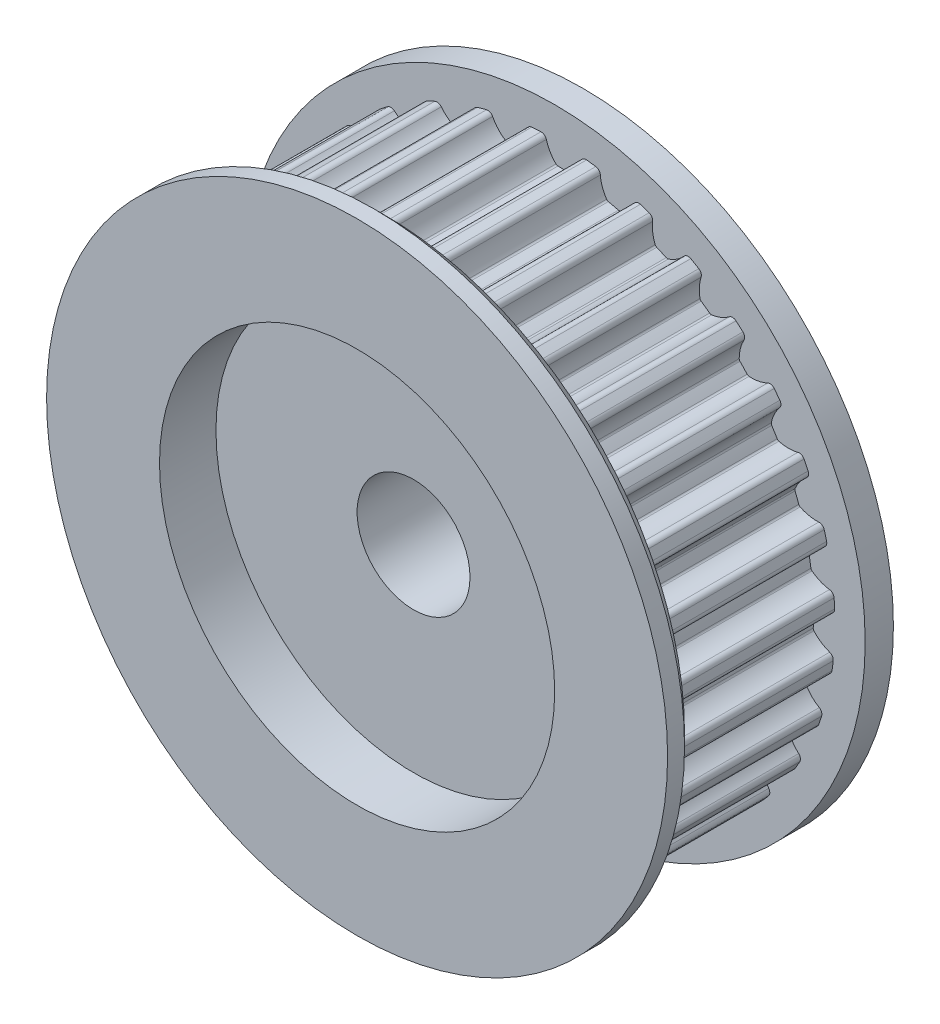
from build123d import *

# Parameters (mm, degrees)
BOSS_EXTRUDE1_DEPTH = 6
SKETCH2_R           = 11
BOSS_EXTRUDE2_DEPTH = 1
BOSS_EXTRUDE3_START = 1
SKETCH3_R           = 11
BOSS_EXTRUDE3_DEPTH = 1
SKETCH4_R           = 2
CUT_EXTRUDE1_DEPTH  = 18.492855685
CHAMFER1_SIZE       = 0.4
SKETCH5_R           = 7
CUT_EXTRUDE2_DEPTH  = 2


with BuildPart() as part:
    # Model → Boss-Extrude1 (new body)
    with BuildSketch(Plane.XY):
        with BuildLine():
            ThreePointArc((-2.731015397, 9.549145454), (-2.833543798, 9.476675356), (-2.86848663, 9.356081051))
            ThreePointArc((-2.86848663, 9.356081051), (-2.893499882, 9.017536319), (-3.003713406, 8.69645817))
            ThreePointArc((-3.003713406, 8.69645817), (-3.026976069, 8.665984152), (-3.059995667, 8.646502791))
            ThreePointArc((-3.059995667, 8.646502791), (-3.2331115, 8.583272921), (-3.40492191, 8.51657741))
            ThreePointArc((-3.40492191, 8.51657741), (-3.442588532, 8.509432981), (-3.480175251, 8.516986507))
            ThreePointArc((-3.480175251, 8.516986507), (-3.774829061, 8.685560914), (-4.016979165, 8.923471666))
            ThreePointArc((-4.016979165, 8.923471666), (-4.122799746, 8.991043795), (-4.247660567, 8.977861867))
            ThreePointArc((-4.247660567, 8.977861867), (-4.395171024, 8.906575979), (-4.541485564, 8.832866628))
            ThreePointArc((-4.541485564, 8.832866628), (-4.627905695, 8.741786725), (-4.638650329, 8.616692597))
            ThreePointArc((-4.638650329, 8.616692597), (-4.597136157, 8.279773063), (-4.64259272, 7.943362749))
            ThreePointArc((-4.64259272, 7.943362749), (-4.659463212, 7.908935961), (-4.688047722, 7.883387125))
            ThreePointArc((-4.688047722, 7.883387125), (-4.845501647, 7.787598975), (-5.00099912, 7.688666452))
            ThreePointArc((-5.00099912, 7.688666452), (-5.036548179, 7.674310907), (-5.0748863, 7.674386489))
            ThreePointArc((-5.0748863, 7.674386489), (-5.396765655, 7.782237679), (-5.680676997, 7.968335901))
            ThreePointArc((-5.680676997, 7.968335901), (-5.797646934, 8.013965079), (-5.917536923, 7.976677301))
            ThreePointArc((-5.917536923, 7.976677301), (-6.048305821, 7.877983288), (-6.177428987, 7.777145692))
            ThreePointArc((-6.177428987, 7.777145692), (-6.244419772, 7.670956132), (-6.230553297, 7.546169478))
            ThreePointArc((-6.230553297, 7.546169478), (-6.124107068, 7.223822772), (-6.1030598, 6.885008353))
            ThreePointArc((-6.1030598, 6.885008353), (-6.112889796, 6.847951796), (-6.135940732, 6.817317312))
            ThreePointArc((-6.135940732, 6.817317312), (-6.271681883, 6.692651967), (-6.404890738, 6.565284353))
            ThreePointArc((-6.404890738, 6.565284353), (-6.436956104, 6.544269369), (-6.474572314, 6.536864102))
            ThreePointArc((-6.474572314, 6.536864102), (-6.811307571, 6.579847415), (-7.126069598, 6.706981456))
            ThreePointArc((-7.126069598, 6.706981456), (-7.249693802, 6.72891418), (-7.360005654, 6.668953499))
            ThreePointArc((-7.360005654, 6.668953499), (-7.469007617, 6.546644118), (-7.575977278, 6.422553408))
            ThreePointArc((-7.575977278, 6.422553408), (-7.620964299, 6.305334997), (-7.583019596, 6.185651299))
            ThreePointArc((-7.583019596, 6.185651299), (-7.415731979, 5.890265023), (-7.328989713, 5.562066946))
            ThreePointArc((-7.328989713, 5.562066946), (-7.331401454, 5.523804683), (-7.348032981, 5.489261818))
            ThreePointArc((-7.348032981, 5.489261818), (-7.456844902, 5.340510098), (-7.562645997, 5.189602059))
            ThreePointArc((-7.562645997, 5.189602059), (-7.589995416, 5.162735229), (-7.625444145, 5.148133693))
            ThreePointArc((-7.625444145, 5.148133693), (-7.964094757, 5.124597304), (-8.297611341, 5.187881476))
            ThreePointArc((-8.297611341, 5.187881476), (-8.423139002, 5.185274883), (-8.519633495, 5.104945555))
            ThreePointArc((-8.519633495, 5.104945555), (-8.60267964, 4.963721086), (-8.683385012, 4.821145998))
            ThreePointArc((-8.683385012, 4.821145998), (-8.704639442, 4.697403374), (-8.644074704, 4.587422009))
            ThreePointArc((-8.644074704, 4.587422009), (-8.422374468, 4.330347693), (-8.273270663, 4.025378426))
            ThreePointArc((-8.273270663, 4.025378426), (-8.268171465, 3.987380855), (-8.277744444, 3.950257071))
            ThreePointArc((-8.277744444, 3.950257071), (-8.355445553, 3.783135421), (-8.429773011, 3.614486267))
            ThreePointArc((-8.429773011, 3.614486267), (-8.45135546, 3.582800069), (-8.483274434, 3.561563394))
            ThreePointArc((-8.483274434, 3.561563394), (-8.810826248, 3.472411793), (-9.150280534, 3.469414119))
            ThreePointArc((-9.150280534, 3.469414119), (-9.272887695, 3.442368379), (-9.351856598, 3.344757415))
            ThreePointArc((-9.351856598, 3.344757415), (-9.405755508, 3.190045036), (-9.457095129, 3.034464652))
            ThreePointArc((-9.457095129, 3.034464652), (-9.453800172, 2.908953173), (-9.372942869, 2.812900664))
            ThreePointArc((-9.372942869, 2.812900664), (-9.10534983, 2.604017529), (-8.89961446, 2.333996871))
            ThreePointArc((-8.89961446, 2.333996871), (-8.887200283, 2.297724216), (-8.889346829, 2.25944616))
            ThreePointArc((-8.889346829, 2.25944616), (-8.932951117, 2.080376971), (-8.972948576, 1.900467796))
            ThreePointArc((-8.972948576, 1.900467796), (-8.987934654, 1.865179912), (-9.015097244, 1.838124211))
            ThreePointArc((-9.015097244, 1.838124211), (-9.318962627, 1.686783444), (-9.651309577, 1.617619124))
            ThreePointArc((-9.651309577, 1.617619124), (-9.766284514, 1.56717359), (-9.824693097, 1.456032124))
            ThreePointArc((-9.824693097, 1.456032124), (-9.847373466, 1.293777344), (-9.867374384, 1.13117053))
            ThreePointArc((-9.867374384, 1.13117053), (-9.839656664, 1.008713534), (-9.741614097, 0.930281124))
            ThreePointArc((-9.741614097, 0.930281124), (-9.438411705, 0.777616432), (-9.183951065, 0.552921124))
            ThreePointArc((-9.183951065, 0.552921124), (-9.164698979, 0.519767324), (-9.159336601, 0.481806))
            ThreePointArc((-9.159336601, 0.481806), (-9.167168379, 0.297670801), (-9.17129876, 0.113415413))
            ThreePointArc((-9.17129876, 0.113415413), (-9.17911256, 0.075881937), (-9.200474922, 0.044046945))
            ThreePointArc((-9.200474922, 0.044046945), (-9.468976498, -0.163667046), (-9.781444205, -0.296340067))
            ThreePointArc((-9.781444205, -0.296340067), (-9.884368495, -0.368246802), (-9.91997215, -0.488647665))
            ThreePointArc((-9.91997215, -0.488647665), (-9.910562385, -0.652209485), (-9.898455975, -0.81559384))
            ThreePointArc((-9.898455975, -0.81559384), (-9.847380668, -0.930290401), (-9.735920557, -0.988088598))
            ThreePointArc((-9.735920557, -0.988088598), (-9.408760711, -1.078668029), (-9.115353581, -1.249403071))
            ThreePointArc((-9.115353581, -1.249403071), (-9.090003433, -1.278163934), (-9.077338205, -1.314349694))
            ThreePointArc((-9.077338205, -1.314349694), (-9.049096502, -1.496474691), (-9.017201075, -1.677995461))
            ThreePointArc((-9.017201075, -1.677995461), (-9.017542317, -1.716332138), (-9.032283509, -1.75172302))
            ThreePointArc((-9.032283509, -1.75172302), (-9.255102913, -2.007827904), (-9.535683419, -2.198911076))
            ThreePointArc((-9.535683419, -2.198911076), (-9.622601739, -2.289515676), (-9.634032237, -2.414548998))
            ThreePointArc((-9.634032237, -2.414548998), (-9.592893949, -2.57313227), (-9.549145454, -2.731015397))
            ThreePointArc((-9.549145454, -2.731015397), (-9.476675356, -2.833543798), (-9.356081051, -2.86848663))
            ThreePointArc((-9.356081051, -2.86848663), (-9.017536319, -2.893499882), (-8.69645817, -3.003713406))
            ThreePointArc((-8.69645817, -3.003713406), (-8.665984152, -3.026976069), (-8.646502791, -3.059995667))
            ThreePointArc((-8.646502791, -3.059995667), (-8.583272921, -3.2331115), (-8.51657741, -3.40492191))
            ThreePointArc((-8.51657741, -3.40492191), (-8.509432981, -3.442588532), (-8.516986507, -3.480175251))
            ThreePointArc((-8.516986507, -3.480175251), (-8.685560914, -3.774829061), (-8.923471666, -4.016979165))
            ThreePointArc((-8.923471666, -4.016979165), (-8.991043795, -4.122799746), (-8.977861867, -4.247660567))
            ThreePointArc((-8.977861867, -4.247660567), (-8.906575979, -4.395171024), (-8.832866628, -4.541485564))
            ThreePointArc((-8.832866628, -4.541485564), (-8.741786725, -4.627905695), (-8.616692597, -4.638650329))
            ThreePointArc((-8.616692597, -4.638650329), (-8.279773063, -4.597136157), (-7.943362749, -4.64259272))
            ThreePointArc((-7.943362749, -4.64259272), (-7.908935961, -4.659463212), (-7.883387125, -4.688047722))
            ThreePointArc((-7.883387125, -4.688047722), (-7.787598975, -4.845501647), (-7.688666452, -5.00099912))
            ThreePointArc((-7.688666452, -5.00099912), (-7.674310907, -5.036548179), (-7.674386489, -5.0748863))
            ThreePointArc((-7.674386489, -5.0748863), (-7.782237679, -5.396765655), (-7.968335901, -5.680676997))
            ThreePointArc((-7.968335901, -5.680676997), (-8.013965079, -5.797646934), (-7.976677301, -5.917536923))
            ThreePointArc((-7.976677301, -5.917536923), (-7.877983288, -6.048305821), (-7.777145692, -6.177428987))
            ThreePointArc((-7.777145692, -6.177428987), (-7.670956132, -6.244419772), (-7.546169478, -6.230553297))
            ThreePointArc((-7.546169478, -6.230553297), (-7.223822772, -6.124107068), (-6.885008353, -6.1030598))
            ThreePointArc((-6.885008353, -6.1030598), (-6.847951796, -6.112889796), (-6.817317312, -6.135940732))
            ThreePointArc((-6.817317312, -6.135940732), (-6.692651967, -6.271681883), (-6.565284353, -6.404890738))
            ThreePointArc((-6.565284353, -6.404890738), (-6.544269369, -6.436956104), (-6.536864102, -6.474572314))
            ThreePointArc((-6.536864102, -6.474572314), (-6.579847415, -6.811307571), (-6.706981456, -7.126069598))
            ThreePointArc((-6.706981456, -7.126069598), (-6.72891418, -7.249693802), (-6.668953499, -7.360005654))
            ThreePointArc((-6.668953499, -7.360005654), (-6.546644118, -7.469007617), (-6.422553408, -7.575977278))
            ThreePointArc((-6.422553408, -7.575977278), (-6.305334997, -7.620964299), (-6.185651299, -7.583019596))
            ThreePointArc((-6.185651299, -7.583019596), (-5.890265023, -7.415731979), (-5.562066946, -7.328989713))
            ThreePointArc((-5.562066946, -7.328989713), (-5.523804683, -7.331401454), (-5.489261818, -7.348032981))
            ThreePointArc((-5.489261818, -7.348032981), (-5.340510098, -7.456844902), (-5.189602059, -7.562645997))
            ThreePointArc((-5.189602059, -7.562645997), (-5.162735229, -7.589995416), (-5.148133693, -7.625444145))
            ThreePointArc((-5.148133693, -7.625444145), (-5.124597304, -7.964094757), (-5.187881476, -8.297611341))
            ThreePointArc((-5.187881476, -8.297611341), (-5.185274883, -8.423139002), (-5.104945555, -8.519633495))
            ThreePointArc((-5.104945555, -8.519633495), (-4.963721086, -8.60267964), (-4.821145998, -8.683385012))
            ThreePointArc((-4.821145998, -8.683385012), (-4.697403374, -8.704639442), (-4.587422009, -8.644074704))
            ThreePointArc((-4.587422009, -8.644074704), (-4.330347693, -8.422374468), (-4.025378426, -8.273270663))
            ThreePointArc((-4.025378426, -8.273270663), (-3.987380855, -8.268171465), (-3.950257071, -8.277744444))
            ThreePointArc((-3.950257071, -8.277744444), (-3.783135421, -8.355445553), (-3.614486267, -8.429773011))
            ThreePointArc((-3.614486267, -8.429773011), (-3.582800069, -8.45135546), (-3.561563394, -8.483274434))
            ThreePointArc((-3.561563394, -8.483274434), (-3.472411793, -8.810826248), (-3.469414119, -9.150280534))
            ThreePointArc((-3.469414119, -9.150280534), (-3.442368379, -9.272887695), (-3.344757415, -9.351856598))
            ThreePointArc((-3.344757415, -9.351856598), (-3.190045036, -9.405755508), (-3.034464652, -9.457095129))
            ThreePointArc((-3.034464652, -9.457095129), (-2.908953173, -9.453800172), (-2.812900664, -9.372942869))
            ThreePointArc((-2.812900664, -9.372942869), (-2.604017529, -9.10534983), (-2.333996871, -8.89961446))
            ThreePointArc((-2.333996871, -8.89961446), (-2.297724216, -8.887200283), (-2.25944616, -8.889346829))
            ThreePointArc((-2.25944616, -8.889346829), (-2.080376971, -8.932951117), (-1.900467796, -8.972948576))
            ThreePointArc((-1.900467796, -8.972948576), (-1.865179912, -8.987934654), (-1.838124211, -9.015097244))
            ThreePointArc((-1.838124211, -9.015097244), (-1.686783444, -9.318962627), (-1.617619124, -9.651309577))
            ThreePointArc((-1.617619124, -9.651309577), (-1.56717359, -9.766284514), (-1.456032124, -9.824693097))
            ThreePointArc((-1.456032124, -9.824693097), (-1.293777344, -9.847373466), (-1.13117053, -9.867374384))
            ThreePointArc((-1.13117053, -9.867374384), (-1.008713534, -9.839656664), (-0.930281124, -9.741614097))
            ThreePointArc((-0.930281124, -9.741614097), (-0.777616432, -9.438411705), (-0.552921124, -9.183951065))
            ThreePointArc((-0.552921124, -9.183951065), (-0.519767324, -9.164698979), (-0.481806, -9.159336601))
            ThreePointArc((-0.481806, -9.159336601), (-0.297670801, -9.167168379), (-0.113415413, -9.17129876))
            ThreePointArc((-0.113415413, -9.17129876), (-0.075881937, -9.17911256), (-0.044046945, -9.200474922))
            ThreePointArc((-0.044046945, -9.200474922), (0.163667046, -9.468976498), (0.296340067, -9.781444205))
            ThreePointArc((0.296340067, -9.781444205), (0.368246802, -9.884368495), (0.488647665, -9.91997215))
            ThreePointArc((0.488647665, -9.91997215), (0.652209485, -9.910562385), (0.81559384, -9.898455975))
            ThreePointArc((0.81559384, -9.898455975), (0.930290401, -9.847380668), (0.988088598, -9.735920557))
            ThreePointArc((0.988088598, -9.735920557), (1.078668029, -9.408760711), (1.249403071, -9.115353581))
            ThreePointArc((1.249403071, -9.115353581), (1.278163934, -9.090003433), (1.314349694, -9.077338205))
            ThreePointArc((1.314349694, -9.077338205), (1.496474691, -9.049096502), (1.677995461, -9.017201075))
            ThreePointArc((1.677995461, -9.017201075), (1.716332138, -9.017542317), (1.75172302, -9.032283509))
            ThreePointArc((1.75172302, -9.032283509), (2.007827904, -9.255102913), (2.198911076, -9.535683419))
            ThreePointArc((2.198911076, -9.535683419), (2.289515676, -9.622601739), (2.414548998, -9.634032237))
            ThreePointArc((2.414548998, -9.634032237), (2.57313227, -9.592893949), (2.731015397, -9.549145454))
            ThreePointArc((2.731015397, -9.549145454), (2.833543798, -9.476675356), (2.86848663, -9.356081051))
            ThreePointArc((2.86848663, -9.356081051), (2.893499882, -9.017536319), (3.003713406, -8.69645817))
            ThreePointArc((3.003713406, -8.69645817), (3.026976069, -8.665984152), (3.059995667, -8.646502791))
            ThreePointArc((3.059995667, -8.646502791), (3.2331115, -8.583272921), (3.40492191, -8.51657741))
            ThreePointArc((3.40492191, -8.51657741), (3.442588532, -8.509432981), (3.480175251, -8.516986507))
            ThreePointArc((3.480175251, -8.516986507), (3.774829061, -8.685560914), (4.016979165, -8.923471666))
            ThreePointArc((4.016979165, -8.923471666), (4.122799746, -8.991043795), (4.247660567, -8.977861867))
            ThreePointArc((4.247660567, -8.977861867), (4.395171024, -8.906575979), (4.541485564, -8.832866628))
            ThreePointArc((4.541485564, -8.832866628), (4.627905695, -8.741786725), (4.638650329, -8.616692597))
            ThreePointArc((4.638650329, -8.616692597), (4.597136157, -8.279773063), (4.64259272, -7.943362749))
            ThreePointArc((4.64259272, -7.943362749), (4.659463212, -7.908935961), (4.688047722, -7.883387125))
            ThreePointArc((4.688047722, -7.883387125), (4.845501647, -7.787598975), (5.00099912, -7.688666452))
            ThreePointArc((5.00099912, -7.688666452), (5.036548179, -7.674310907), (5.0748863, -7.674386489))
            ThreePointArc((5.0748863, -7.674386489), (5.396765655, -7.782237679), (5.680676997, -7.968335901))
            ThreePointArc((5.680676997, -7.968335901), (5.797646934, -8.013965079), (5.917536923, -7.976677301))
            ThreePointArc((5.917536923, -7.976677301), (6.048305821, -7.877983288), (6.177428987, -7.777145692))
            ThreePointArc((6.177428987, -7.777145692), (6.244419772, -7.670956132), (6.230553297, -7.546169478))
            ThreePointArc((6.230553297, -7.546169478), (6.124107068, -7.223822772), (6.1030598, -6.885008353))
            ThreePointArc((6.1030598, -6.885008353), (6.112889796, -6.847951796), (6.135940732, -6.817317312))
            ThreePointArc((6.135940732, -6.817317312), (6.271681883, -6.692651967), (6.404890738, -6.565284353))
            ThreePointArc((6.404890738, -6.565284353), (6.436956104, -6.544269369), (6.474572314, -6.536864102))
            ThreePointArc((6.474572314, -6.536864102), (6.811307571, -6.579847415), (7.126069598, -6.706981456))
            ThreePointArc((7.126069598, -6.706981456), (7.249693802, -6.72891418), (7.360005654, -6.668953499))
            ThreePointArc((7.360005654, -6.668953499), (7.469007617, -6.546644118), (7.575977278, -6.422553408))
            ThreePointArc((7.575977278, -6.422553408), (7.620964299, -6.305334997), (7.583019596, -6.185651299))
            ThreePointArc((7.583019596, -6.185651299), (7.415731979, -5.890265023), (7.328989713, -5.562066946))
            ThreePointArc((7.328989713, -5.562066946), (7.331401454, -5.523804683), (7.348032981, -5.489261818))
            ThreePointArc((7.348032981, -5.489261818), (7.456844902, -5.340510098), (7.562645997, -5.189602059))
            ThreePointArc((7.562645997, -5.189602059), (7.589995416, -5.162735229), (7.625444145, -5.148133693))
            ThreePointArc((7.625444145, -5.148133693), (7.964094757, -5.124597304), (8.297611341, -5.187881476))
            ThreePointArc((8.297611341, -5.187881476), (8.423139002, -5.185274883), (8.519633495, -5.104945555))
            ThreePointArc((8.519633495, -5.104945555), (8.60267964, -4.963721086), (8.683385012, -4.821145998))
            ThreePointArc((8.683385012, -4.821145998), (8.704639442, -4.697403374), (8.644074704, -4.587422009))
            ThreePointArc((8.644074704, -4.587422009), (8.422374468, -4.330347693), (8.273270663, -4.025378426))
            ThreePointArc((8.273270663, -4.025378426), (8.268171465, -3.987380855), (8.277744444, -3.950257071))
            ThreePointArc((8.277744444, -3.950257071), (8.355445553, -3.783135421), (8.429773011, -3.614486267))
            ThreePointArc((8.429773011, -3.614486267), (8.45135546, -3.582800069), (8.483274434, -3.561563394))
            ThreePointArc((8.483274434, -3.561563394), (8.810826248, -3.472411793), (9.150280534, -3.469414119))
            ThreePointArc((9.150280534, -3.469414119), (9.272887695, -3.442368379), (9.351856598, -3.344757415))
            ThreePointArc((9.351856598, -3.344757415), (9.405755508, -3.190045036), (9.457095129, -3.034464652))
            ThreePointArc((9.457095129, -3.034464652), (9.453800172, -2.908953173), (9.372942869, -2.812900664))
            ThreePointArc((9.372942869, -2.812900664), (9.10534983, -2.604017529), (8.89961446, -2.333996871))
            ThreePointArc((8.89961446, -2.333996871), (8.887200283, -2.297724216), (8.889346829, -2.25944616))
            ThreePointArc((8.889346829, -2.25944616), (8.932951117, -2.080376971), (8.972948576, -1.900467796))
            ThreePointArc((8.972948576, -1.900467796), (8.987934654, -1.865179912), (9.015097244, -1.838124211))
            ThreePointArc((9.015097244, -1.838124211), (9.318962627, -1.686783444), (9.651309577, -1.617619124))
            ThreePointArc((9.651309577, -1.617619124), (9.766284514, -1.56717359), (9.824693097, -1.456032124))
            ThreePointArc((9.824693097, -1.456032124), (9.847373466, -1.293777344), (9.867374384, -1.13117053))
            ThreePointArc((9.867374384, -1.13117053), (9.839656664, -1.008713534), (9.741614097, -0.930281124))
            ThreePointArc((9.741614097, -0.930281124), (9.438411705, -0.777616432), (9.183951065, -0.552921124))
            ThreePointArc((9.183951065, -0.552921124), (9.164698979, -0.519767324), (9.159336601, -0.481806))
            ThreePointArc((9.159336601, -0.481806), (9.167168379, -0.297670801), (9.17129876, -0.113415413))
            ThreePointArc((9.17129876, -0.113415413), (9.17911256, -0.075881937), (9.200474922, -0.044046945))
            ThreePointArc((9.200474922, -0.044046945), (9.468976498, 0.163667046), (9.781444205, 0.296340067))
            ThreePointArc((9.781444205, 0.296340067), (9.884368495, 0.368246802), (9.91997215, 0.488647665))
            ThreePointArc((9.91997215, 0.488647665), (9.910562385, 0.652209485), (9.898455975, 0.81559384))
            ThreePointArc((9.898455975, 0.81559384), (9.847380668, 0.930290401), (9.735920557, 0.988088598))
            ThreePointArc((9.735920557, 0.988088598), (9.408760711, 1.078668029), (9.115353581, 1.249403071))
            ThreePointArc((9.115353581, 1.249403071), (9.090003433, 1.278163934), (9.077338205, 1.314349694))
            ThreePointArc((9.077338205, 1.314349694), (9.049096502, 1.496474691), (9.017201075, 1.677995461))
            ThreePointArc((9.017201075, 1.677995461), (9.017542317, 1.716332138), (9.032283509, 1.75172302))
            ThreePointArc((9.032283509, 1.75172302), (9.255102913, 2.007827904), (9.535683419, 2.198911076))
            ThreePointArc((9.535683419, 2.198911076), (9.622601739, 2.289515676), (9.634032237, 2.414548998))
            ThreePointArc((9.634032237, 2.414548998), (9.592893949, 2.57313227), (9.549145454, 2.731015397))
            ThreePointArc((9.549145454, 2.731015397), (9.476675356, 2.833543798), (9.356081051, 2.86848663))
            ThreePointArc((9.356081051, 2.86848663), (9.017536319, 2.893499882), (8.69645817, 3.003713406))
            ThreePointArc((8.69645817, 3.003713406), (8.665984152, 3.026976069), (8.646502791, 3.059995667))
            ThreePointArc((8.646502791, 3.059995667), (8.583272921, 3.2331115), (8.51657741, 3.40492191))
            ThreePointArc((8.51657741, 3.40492191), (8.509432981, 3.442588532), (8.516986507, 3.480175251))
            ThreePointArc((8.516986507, 3.480175251), (8.685560914, 3.774829061), (8.923471666, 4.016979165))
            ThreePointArc((8.923471666, 4.016979165), (8.991043795, 4.122799746), (8.977861867, 4.247660567))
            ThreePointArc((8.977861867, 4.247660567), (8.906575979, 4.395171024), (8.832866628, 4.541485564))
            ThreePointArc((8.832866628, 4.541485564), (8.741786725, 4.627905695), (8.616692597, 4.638650329))
            ThreePointArc((8.616692597, 4.638650329), (8.279773063, 4.597136157), (7.943362749, 4.64259272))
            ThreePointArc((7.943362749, 4.64259272), (7.908935961, 4.659463212), (7.883387125, 4.688047722))
            ThreePointArc((7.883387125, 4.688047722), (7.787598975, 4.845501647), (7.688666452, 5.00099912))
            ThreePointArc((7.688666452, 5.00099912), (7.674310907, 5.036548179), (7.674386489, 5.0748863))
            ThreePointArc((7.674386489, 5.0748863), (7.782237679, 5.396765655), (7.968335901, 5.680676997))
            ThreePointArc((7.968335901, 5.680676997), (8.013965079, 5.797646934), (7.976677301, 5.917536923))
            ThreePointArc((7.976677301, 5.917536923), (7.877983288, 6.048305821), (7.777145692, 6.177428987))
            ThreePointArc((7.777145692, 6.177428987), (7.670956132, 6.244419772), (7.546169478, 6.230553297))
            ThreePointArc((7.546169478, 6.230553297), (7.223822772, 6.124107068), (6.885008353, 6.1030598))
            ThreePointArc((6.885008353, 6.1030598), (6.847951796, 6.112889796), (6.817317312, 6.135940732))
            ThreePointArc((6.817317312, 6.135940732), (6.692651967, 6.271681883), (6.565284353, 6.404890738))
            ThreePointArc((6.565284353, 6.404890738), (6.544269369, 6.436956104), (6.536864102, 6.474572314))
            ThreePointArc((6.536864102, 6.474572314), (6.579847415, 6.811307571), (6.706981456, 7.126069598))
            ThreePointArc((6.706981456, 7.126069598), (6.72891418, 7.249693802), (6.668953499, 7.360005654))
            ThreePointArc((6.668953499, 7.360005654), (6.546644118, 7.469007617), (6.422553408, 7.575977278))
            ThreePointArc((6.422553408, 7.575977278), (6.305334997, 7.620964299), (6.185651299, 7.583019596))
            ThreePointArc((6.185651299, 7.583019596), (5.890265023, 7.415731979), (5.562066946, 7.328989713))
            ThreePointArc((5.562066946, 7.328989713), (5.523804683, 7.331401454), (5.489261818, 7.348032981))
            ThreePointArc((5.489261818, 7.348032981), (5.340510098, 7.456844902), (5.189602059, 7.562645997))
            ThreePointArc((5.189602059, 7.562645997), (5.162735229, 7.589995416), (5.148133693, 7.625444145))
            ThreePointArc((5.148133693, 7.625444145), (5.124597304, 7.964094757), (5.187881476, 8.297611341))
            ThreePointArc((5.187881476, 8.297611341), (5.185274883, 8.423139002), (5.104945555, 8.519633495))
            ThreePointArc((5.104945555, 8.519633495), (4.963721086, 8.60267964), (4.821145998, 8.683385012))
            ThreePointArc((4.821145998, 8.683385012), (4.697403374, 8.704639442), (4.587422009, 8.644074704))
            ThreePointArc((4.587422009, 8.644074704), (4.330347693, 8.422374468), (4.025378426, 8.273270663))
            ThreePointArc((4.025378426, 8.273270663), (3.987380855, 8.268171465), (3.950257071, 8.277744444))
            ThreePointArc((3.950257071, 8.277744444), (3.783135421, 8.355445553), (3.614486267, 8.429773011))
            ThreePointArc((3.614486267, 8.429773011), (3.582800069, 8.45135546), (3.561563394, 8.483274434))
            ThreePointArc((3.561563394, 8.483274434), (3.472411793, 8.810826248), (3.469414119, 9.150280534))
            ThreePointArc((3.469414119, 9.150280534), (3.442368379, 9.272887695), (3.344757415, 9.351856598))
            ThreePointArc((3.344757415, 9.351856598), (3.190045036, 9.405755508), (3.034464652, 9.457095129))
            ThreePointArc((3.034464652, 9.457095129), (2.908953173, 9.453800172), (2.812900664, 9.372942869))
            ThreePointArc((2.812900664, 9.372942869), (2.604017529, 9.10534983), (2.333996871, 8.89961446))
            ThreePointArc((2.333996871, 8.89961446), (2.297724216, 8.887200283), (2.25944616, 8.889346829))
            ThreePointArc((2.25944616, 8.889346829), (2.080376971, 8.932951117), (1.900467796, 8.972948576))
            ThreePointArc((1.900467796, 8.972948576), (1.865179912, 8.987934654), (1.838124211, 9.015097244))
            ThreePointArc((1.838124211, 9.015097244), (1.686783444, 9.318962627), (1.617619124, 9.651309577))
            ThreePointArc((1.617619124, 9.651309577), (1.56717359, 9.766284514), (1.456032124, 9.824693097))
            ThreePointArc((1.456032124, 9.824693097), (1.293777344, 9.847373466), (1.13117053, 9.867374384))
            ThreePointArc((1.13117053, 9.867374384), (1.008713534, 9.839656664), (0.930281124, 9.741614097))
            ThreePointArc((0.930281124, 9.741614097), (0.777616432, 9.438411705), (0.552921124, 9.183951065))
            ThreePointArc((0.552921124, 9.183951065), (0.519767324, 9.164698979), (0.481806, 9.159336601))
            ThreePointArc((0.481806, 9.159336601), (0.297670801, 9.167168379), (0.113415413, 9.17129876))
            ThreePointArc((0.113415413, 9.17129876), (0.075881937, 9.17911256), (0.044046945, 9.200474922))
            ThreePointArc((0.044046945, 9.200474922), (-0.163667046, 9.468976498), (-0.296340067, 9.781444205))
            ThreePointArc((-0.296340067, 9.781444205), (-0.368246802, 9.884368495), (-0.488647665, 9.91997215))
            ThreePointArc((-0.488647665, 9.91997215), (-0.652209485, 9.910562385), (-0.81559384, 9.898455975))
            ThreePointArc((-0.81559384, 9.898455975), (-0.930290401, 9.847380668), (-0.988088598, 9.735920557))
            ThreePointArc((-0.988088598, 9.735920557), (-1.078668029, 9.408760711), (-1.249403071, 9.115353581))
            ThreePointArc((-1.249403071, 9.115353581), (-1.278163934, 9.090003433), (-1.314349694, 9.077338205))
            ThreePointArc((-1.314349694, 9.077338205), (-1.496474691, 9.049096502), (-1.677995461, 9.017201075))
            ThreePointArc((-1.677995461, 9.017201075), (-1.716332138, 9.017542317), (-1.75172302, 9.032283509))
            ThreePointArc((-1.75172302, 9.032283509), (-2.007827904, 9.255102913), (-2.198911076, 9.535683419))
            ThreePointArc((-2.198911076, 9.535683419), (-2.289515676, 9.622601739), (-2.414548998, 9.634032237))
            ThreePointArc((-2.414548998, 9.634032237), (-2.57313227, 9.592893949), (-2.731015397, 9.549145454))
        make_face()
    extrude(amount=BOSS_EXTRUDE1_DEPTH)

    # Sketch2 → Boss-Extrude2 (add)
    with BuildSketch(Plane(origin=(0, 0, 0), x_dir=(-1, 0, 0), z_dir=(0, 0, -1))):
        Circle(SKETCH2_R)
    extrude(amount=BOSS_EXTRUDE2_DEPTH)

    # Sketch3 → Boss-Extrude3 (add)
    with BuildSketch(Plane.XY.offset(6).offset(BOSS_EXTRUDE3_START)):
        with Locations(Location((0, 0, 0), (0, 0, 180))):
            Circle(SKETCH3_R)
    extrude(amount=-BOSS_EXTRUDE3_DEPTH)

    # Sketch4 → Cut-Extrude1 (cut, through all)
    with BuildSketch(Plane.XY.offset(7)):
        Circle(SKETCH4_R)
    extrude(amount=-CUT_EXTRUDE1_DEPTH, mode=Mode.SUBTRACT)

    # Chamfer1
    chamfer1_edges = [part.edges().sort_by_distance(p)[0] for p in [
        (11, 0, 6),
    ]]
    chamfer(chamfer1_edges, length=CHAMFER1_SIZE)

    # Sketch5 → Cut-Extrude2 (cut)
    with BuildSketch(Plane.XY.offset(7)):
        Circle(SKETCH5_R)
    extrude(amount=-CUT_EXTRUDE2_DEPTH, mode=Mode.SUBTRACT)


solid = part.part
